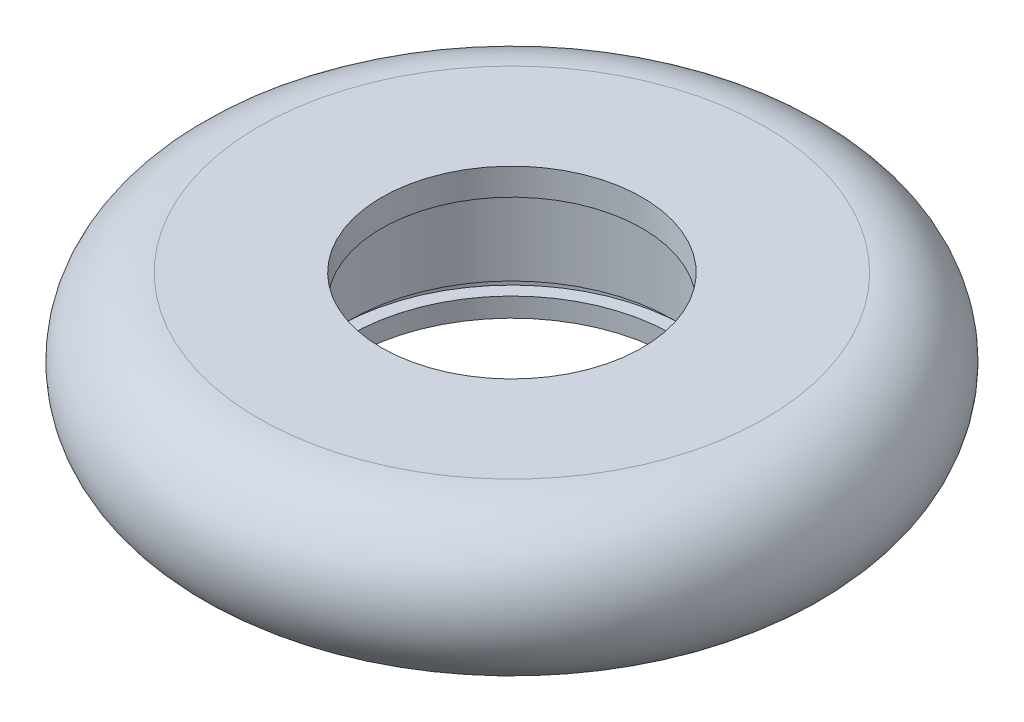
from build123d import *

# Parameters (mm, degrees)
SKETCH_5_R          = 21
CUT_EXTRUDE_1_DEPTH = 16.5
SKETCH_6_W          = 1.75
SKETCH_6_H          = 1.7
SKETCH_7_R          = 17
CUT_EXTRUDE_2_DEPTH = 16


with BuildPart() as part:
    # 草图1 → 旋转1 (revolve)
    with BuildSketch(Plane.XY, mode=Mode.PRIVATE) as revolve_1_sk:
        with BuildLine():
            Line((10, 0), (33, 0))
            ThreePointArc((33, 0), (43, 10), (33, 20))
            Line((33, 20), (10, 20))
            Line((10, 20), (10, 0))
        make_face()
    revolve(revolve_1_sk.sketch.rotate(Axis((0, 0, 0), (0, 1, 0)), 90), axis=Axis((0, 0, 0), (0, 1, 0)))

    # 草图5 → 切除-拉伸1 (cut)
    with BuildSketch(Plane.XZ):
        with Locations(Location((0, 0, 0), (0, 0, 270))):
            Circle(SKETCH_5_R)
    extrude(amount=-CUT_EXTRUDE_1_DEPTH, mode=Mode.SUBTRACT)

    # 草图6 → 切除-旋转1 (revolve, cut)
    with BuildSketch(Plane(origin=(0, 0, 0), x_dir=(0, 0, -1), z_dir=(1, 0, 0))):
        with Locations((21.875, 3.35)):
            Rectangle(SKETCH_6_W, SKETCH_6_H)
    revolve(axis=Axis((0, 0, 0), (0, 1, 0)), mode=Mode.SUBTRACT)

    # 草图7 → 切除-拉伸2 (cut)
    with BuildSketch(Plane(origin=(0, 20, 0), x_dir=(1, 0, 0), z_dir=(0, 1, 0))):
        with Locations(Location((0, 0, 0), (0, 0, 270))):
            Circle(SKETCH_7_R)
    extrude(amount=-CUT_EXTRUDE_2_DEPTH, mode=Mode.SUBTRACT)


solid = part.part
